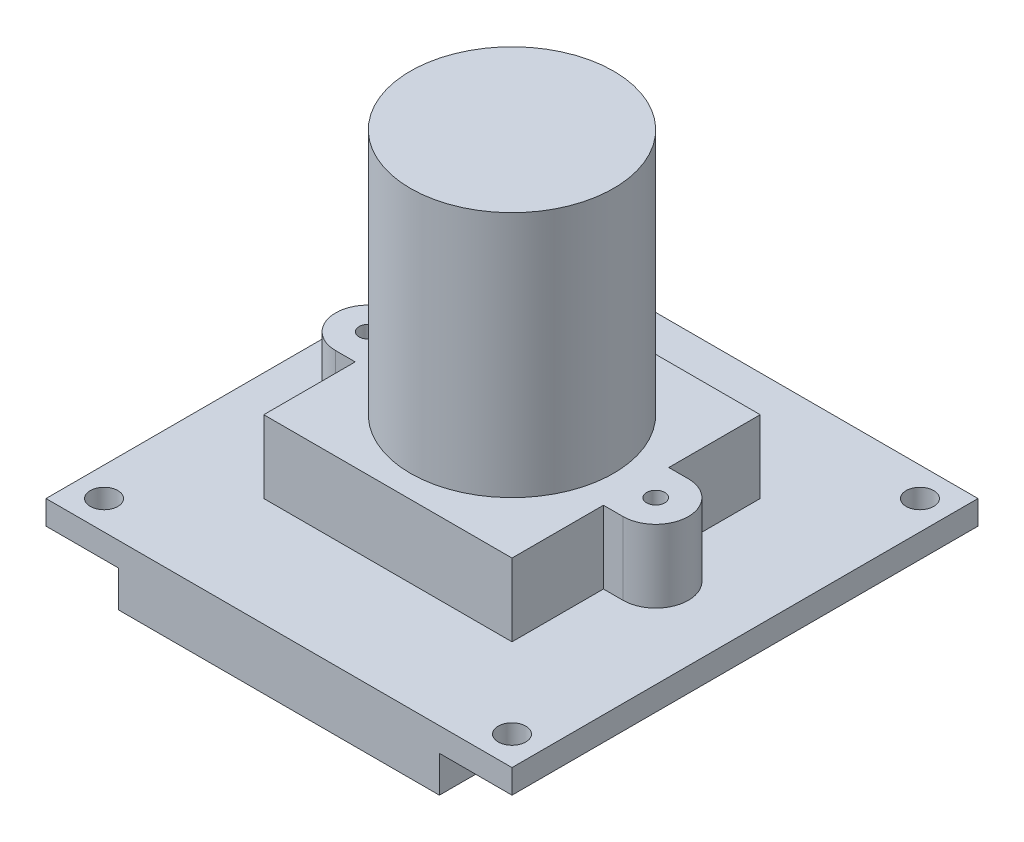
from build123d import *

# Parameters (mm, degrees)
SKETCH1_W           = 32.1
SKETCH1_H           = 32.1
SKETCH1_R           = 0.95
BOSS_EXTRUDE1_DEPTH = 1.65
SKETCH2_W           = 22.1
SKETCH2_H           = 6.75
BOSS_EXTRUDE2_DEPTH = 2.5
SKETCH3_R           = 0.625
BOSS_EXTRUDE3_DEPTH = 5
SKETCH4_R           = 7
BOSS_EXTRUDE4_DEPTH = 17


with BuildPart() as part:
    # Sketch1 → Boss-Extrude1 (new body)
    with BuildSketch(Plane(origin=(0, 0, 0), x_dir=(1, 0, 0), z_dir=(0, 1, 0))):
        Rectangle(SKETCH1_W, SKETCH1_H)
        with Locations(Location((-14.05, 14.05, 0), (0, 0, 270))):
            Circle(SKETCH1_R, mode=Mode.SUBTRACT)
        with Locations(Location((14.05, 14.05, 0), (0, 0, 90))):
            Circle(SKETCH1_R, mode=Mode.SUBTRACT)
        with Locations(Location((14.05, -14.05, 0), (0, 0, 270))):
            Circle(SKETCH1_R, mode=Mode.SUBTRACT)
        with Locations(Location((-14.05, -14.05, 0), (0, 0, 90))):
            Circle(SKETCH1_R, mode=Mode.SUBTRACT)
    extrude(amount=BOSS_EXTRUDE1_DEPTH)

    # Sketch2 → Boss-Extrude2 (add)
    with BuildSketch(Plane.XZ):
        with Locations((0, 12.675)):
            Rectangle(SKETCH2_W, SKETCH2_H)
    extrude(amount=BOSS_EXTRUDE2_DEPTH)

    # Sketch3 → Boss-Extrude3 (add)
    with BuildSketch(Plane(origin=(0, 1.65, 0), x_dir=(1, 0, 0), z_dir=(0, 1, 0))):
        with BuildLine():
            Line((9.9, 2.25), (8.55, 2.25))
            Line((8.55, 2.25), (8.55, 8.55))
            Line((8.55, 8.55), (-8.55, 8.55))
            Line((-8.55, 8.55), (-8.55, 2.25))
            Line((-8.55, 2.25), (-9.9, 2.25))
            ThreePointArc((-9.9, 2.25), (-12.15, 0), (-9.9, -2.25))
            Line((-9.9, -2.25), (-8.55, -2.25))
            Line((-8.55, -2.25), (-8.55, -8.55))
            Line((-8.55, -8.55), (8.55, -8.55))
            Line((8.55, -8.55), (8.55, -2.25))
            Line((8.55, -2.25), (9.9, -2.25))
            ThreePointArc((9.9, -2.25), (12.15, 0), (9.9, 2.25))
        make_face()
        with Locations(Location((9.9, 0, 0), (0, 0, 270))):
            Circle(SKETCH3_R, mode=Mode.SUBTRACT)
        with Locations(Location((-9.9, 0, 0), (0, 0, 90))):
            Circle(SKETCH3_R, mode=Mode.SUBTRACT)
    extrude(amount=BOSS_EXTRUDE3_DEPTH)

    # Sketch4 → Boss-Extrude4 (add)
    with BuildSketch(Plane(origin=(0, 6.65, 0), x_dir=(1, 0, 0), z_dir=(0, 1, 0))):
        with Locations(Location((0, 0, 0), (0, 0, 270))):
            Circle(SKETCH4_R)
    extrude(amount=BOSS_EXTRUDE4_DEPTH)


solid = part.part
